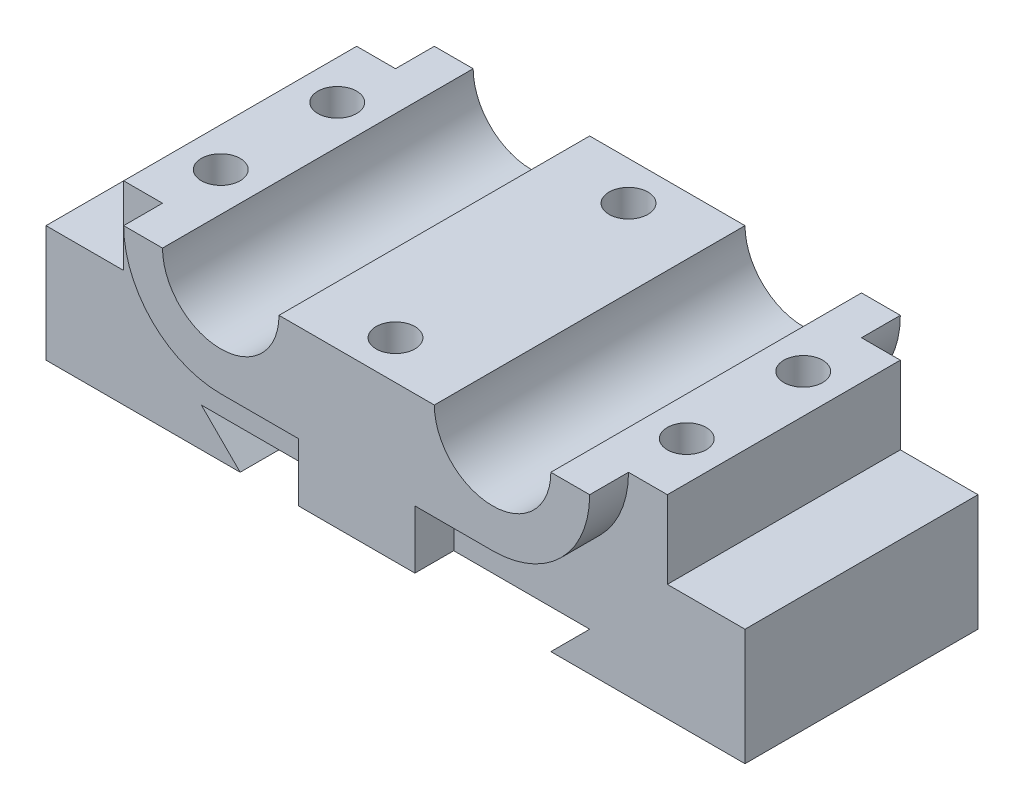
from build123d import *

# Parameters (mm, degrees)
BOSS_EXTRUDE1_DEPTH   = 38.1
BOSS_EXTRUDE1_2_DEPTH = 38.1
BOSS_EXTRUDE2_DEPTH   = 50.8
SKETCH2_R             = 6.35
CUT_EXTRUDE2_DEPTH    = 28.575
SKETCH3_W             = 38.1
SKETCH3_H             = 101.6
CUT_EXTRUDE3_DEPTH    = 12.7


with BuildPart() as part:
    # Sketch1 → Boss-Extrude1 (new, symmetric)
    with BuildSketch(Plane.XY):
        with BuildLine():
            Line((50.8, 0), (114.3, 0))
            Line((114.3, 0), (114.3, 38.1))
            Line((114.3, 38.1), (88.9, 38.1))
            Line((88.9, 38.1), (88.9, 63.5))
            Line((88.9, 63.5), (76.2, 63.5))
            ThreePointArc((76.2, 63.5), (66.900640303, 41.049359697), (44.45, 31.75))
            Line((44.45, 31.75), (19.05, 31.75))
            Line((19.05, 31.75), (19.05, 12.7))
            Line((19.05, 12.7), (63.5, 12.7))
            Line((63.5, 12.7), (50.8, 0))
        make_face()
    extrude(amount=BOSS_EXTRUDE1_DEPTH, both=True)



with BuildPart() as body_2:
    # Sketch1 → Boss-Extrude1 2 (new, symmetric)
    with BuildSketch(Plane.XY):
        with BuildLine():
            Line((-63.5, 12.7), (-19.05, 12.7))
            Line((-19.05, 12.7), (-19.05, 31.75))
            Line((-19.05, 31.75), (-44.45, 31.75))
            ThreePointArc((-44.45, 31.75), (-66.900640303, 41.049359697), (-76.2, 63.5))
            Line((-76.2, 63.5), (-88.9, 63.5))
            Line((-88.9, 63.5), (-88.9, 38.1))
            Line((-88.9, 38.1), (-114.3, 38.1))
            Line((-114.3, 38.1), (-114.3, 0))
            Line((-114.3, 0), (-50.8, 0))
            Line((-50.8, 0), (-63.5, 12.7))
        make_face()
    extrude(amount=BOSS_EXTRUDE1_2_DEPTH, both=True)


with BuildPart() as part_1:
    add(part.part)

    add(body_2.part)  # Boss-Extrude2 merges body 2
    # Sketch1<3> → Boss-Extrude2 (add, symmetric)
    with BuildSketch(Plane.XY):
        with BuildLine():
            Line((19.05, 0), (19.05, 12.7))
            Line((19.05, 12.7), (19.05, 31.75))
            Line((19.05, 31.75), (44.45, 31.75))
            ThreePointArc((44.45, 31.75), (66.900640303, 41.049359697), (76.2, 63.5))
            Line((76.2, 63.5), (63.5, 63.5))
            ThreePointArc((63.5, 63.5), (44.45, 44.45), (25.4, 63.5))
            Line((25.4, 63.5), (0, 63.5))
            Line((0, 63.5), (0, 0))
            Line((0, 0), (19.05, 0))
        make_face()
        with BuildLine():
            Line((-19.05, 0), (0, 0))
            Line((0, 0), (0, 63.5))
            Line((0, 63.5), (-25.4, 63.5))
            ThreePointArc((-25.4, 63.5), (-44.45, 44.45), (-63.5, 63.5))
            Line((-63.5, 63.5), (-76.2, 63.5))
            ThreePointArc((-76.2, 63.5), (-66.900640303, 41.049359697), (-44.45, 31.75))
            Line((-44.45, 31.75), (-19.05, 31.75))
            Line((-19.05, 31.75), (-19.05, 12.7))
            Line((-19.05, 12.7), (-19.05, 0))
        make_face()
    extrude(amount=BOSS_EXTRUDE2_DEPTH, both=True)

    # Sketch2 → Cut-Extrude2 (cut)
    with BuildSketch(Plane(origin=(0, 63.5, 0), x_dir=(1, 0, 0), z_dir=(0, 1, 0))):
        with Locations(Location((-76.2, 19.05, 0), (0, 0, 270))):
            Circle(SKETCH2_R)
        with Locations(Location((0, 38.1, 0), (0, 0, 270))):
            Circle(SKETCH2_R)
        with Locations(Location((76.2, 19.05, 0), (0, 0, 90))):
            Circle(SKETCH2_R)
        with Locations(Location((76.2, -19.05, 0), (0, 0, 270))):
            Circle(SKETCH2_R)
        with Locations(Location((0, -38.1, 0), (0, 0, 90))):
            Circle(SKETCH2_R)
        with Locations(Location((-76.2, -19.05, 0), (0, 0, 90))):
            Circle(SKETCH2_R)
    extrude(amount=-CUT_EXTRUDE2_DEPTH, mode=Mode.SUBTRACT)

    # Sketch3 → Cut-Extrude3 (cut)
    with BuildSketch(Plane.XZ):
        Rectangle(SKETCH3_W, SKETCH3_H)
    extrude(amount=-CUT_EXTRUDE3_DEPTH, mode=Mode.SUBTRACT)


solid = part_1.part
